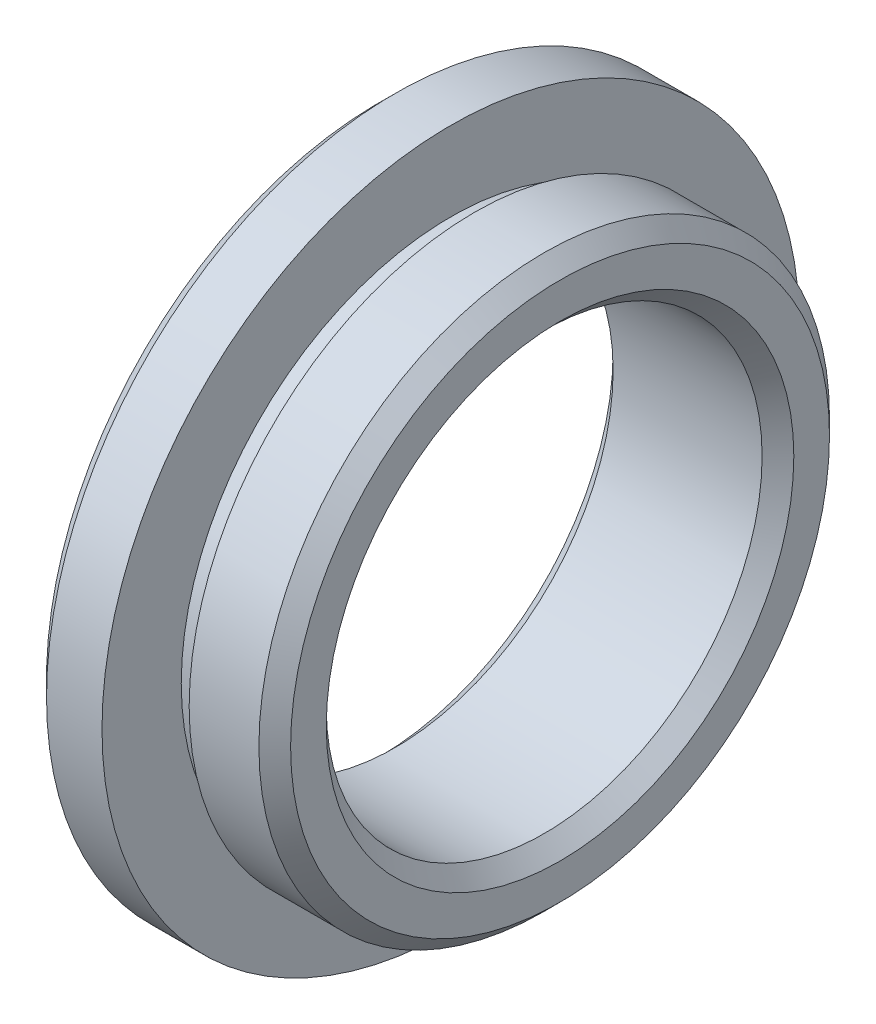
from build123d import *

# Parameters (mm, degrees)
CHANFREIN1_SIZE = 1


with BuildPart() as part:
    # Esquisse1 → Révolution1 (revolve)
    with BuildSketch(Plane.XY, mode=Mode.PRIVATE) as r_volution1_sk:
        Polygon((0, 13.75), (0, 22), (4.5, 22), (4.5, 17), (6, 17), (6, 18), (11.4, 18), (11.4, 13.75), align=None)
    revolve(r_volution1_sk.sketch.rotate(Axis((0, 0, 0), (1, 0, 0)), 90), axis=Axis((0, 0, 0), (1, 0, 0)))

    # Chanfrein1
    chanfrein1_edges = [part.edges().sort_by_distance(p)[0] for p in [
        (11.4, 0, -13.75),
        (11.4, 0, -18),
        (0, 0, -22),
        (0, 0, -13.75),
    ]]
    chamfer(chanfrein1_edges, length=CHANFREIN1_SIZE)

    # Esquisse3 → Diamètre du perçage Ø3.1 (3.1)1 (revolve, cut)
    with BuildSketch(Plane.ZX.offset(18.5)):
        Polygon((0, 0), (0, 4.431333959), (1.55, 3.5), (1.55, 0), align=None)
    diam_tre_du_per_age_3_1_3_1_1 = revolve(axis=Axis((-6.35, 18.5, 0), (1, 0, 0)), mode=Mode.SUBTRACT)

    # Symétrie1: Diamètre du perçage Ø3.1 (3.1)1 across plane
    add(diam_tre_du_per_age_3_1_3_1_1.mirror(Plane.ZX), mode=Mode.SUBTRACT)


solid = part.part
